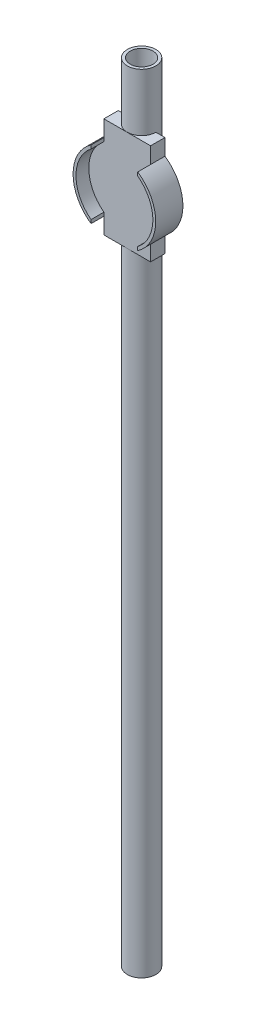
from build123d import *

# Parameters (mm, degrees)
SKETCH1_W           = 0.8
SKETCH1_H           = 219.088379857
BOSS_EXTRUDE2_DEPTH = 4
BOSS_EXTRUDE3_DEPTH = 3.575


with BuildPart() as part:
    # Sketch1 → Revolve1 (revolve)
    with BuildSketch(Plane.XY, mode=Mode.PRIVATE) as revolve1_sk:
        with Locations((3.575, -190.824189929)):
            Rectangle(SKETCH1_W, SKETCH1_H)
    revolve(revolve1_sk.sketch.rotate(Axis((0, 0, 0), (0, -1, 0)), 180), axis=Axis((0, 0, 0), (0, -1, 0)))

    # Sketch17 → Boss-Extrude2 (add)
    with BuildSketch(Plane(origin=(0, 58.900156663, 0), x_dir=(1, 0, 0), z_dir=(0, 0, 1))):
        with BuildLine():
            ThreePointArc((6.5, -160.693323683), (0, -158.680156663), (-6.5, -160.693323683))
            Line((-6.5, -160.693323683), (-6.5, -179.666989644))
            ThreePointArc((-6.5, -179.666989644), (0, -181.680156663), (6.5, -179.666989644))
            Line((6.5, -179.666989644), (6.5, -160.693323683))
        make_face()
        with BuildLine():
            Line((-6.5, -179.666989644), (-6.5, -160.693323683))
            ThreePointArc((-6.5, -160.693323683), (-11.5, -170.180156663), (-6.5, -179.666989644))
        make_face()
        with BuildLine():
            Line((6.5, -156.180156663), (-6.5, -156.180156663))
            Line((-6.5, -156.180156663), (-6.5, -160.693323683))
            ThreePointArc((-6.5, -160.693323683), (0, -158.680156663), (6.5, -160.693323683))
            Line((6.5, -160.693323683), (6.5, -156.180156663))
        make_face()
        with BuildLine():
            ThreePointArc((11.5, -170.180156663), (10.173494975, -164.818254016), (6.5, -160.693323683))
            Line((6.5, -160.693323683), (6.5, -179.666989644))
            ThreePointArc((6.5, -179.666989644), (10.173494975, -175.542059311), (11.5, -170.180156663))
        make_face()
        with BuildLine():
            ThreePointArc((6.5, -179.666989644), (0, -181.680156663), (-6.5, -179.666989644))
            Line((-6.5, -179.666989644), (-6.5, -184.180156663))
            Line((-6.5, -184.180156663), (6.5, -184.180156663))
            Line((6.5, -184.180156663), (6.5, -179.666989644))
        make_face()
    extrude(amount=BOSS_EXTRUDE2_DEPTH)

    # Sketch18 → Boss-Extrude3 (add)
    with BuildSketch(Plane.XY.offset(4)):
        with BuildLine():
            ThreePointArc((-6.5, -101.793167019), (-11.5, -111.28), (-6.5, -120.766832981))
            Line((-6.5, -120.766832981), (-6.5, -119.779411744))
            ThreePointArc((-6.5, -119.779411744), (-10.7, -111.28), (-6.5, -102.780588256))
            Line((-6.5, -102.780588256), (-6.5, -101.793167019))
        make_face()
        with BuildLine():
            Line((6.5, -119.779411744), (6.5, -120.766832981))
            ThreePointArc((6.5, -120.766832981), (10.173494975, -116.641902647), (11.5, -111.28))
            ThreePointArc((11.5, -111.28), (10.173494975, -105.918097353), (6.5, -101.793167019))
            Line((6.5, -101.793167019), (6.5, -102.780588256))
            ThreePointArc((6.5, -102.780588256), (9.592705562, -106.539746842), (10.7, -111.28))
            ThreePointArc((10.7, -111.28), (9.592705562, -116.020253158), (6.5, -119.779411744))
        make_face()
    extrude(amount=BOSS_EXTRUDE3_DEPTH)


solid = part.part
